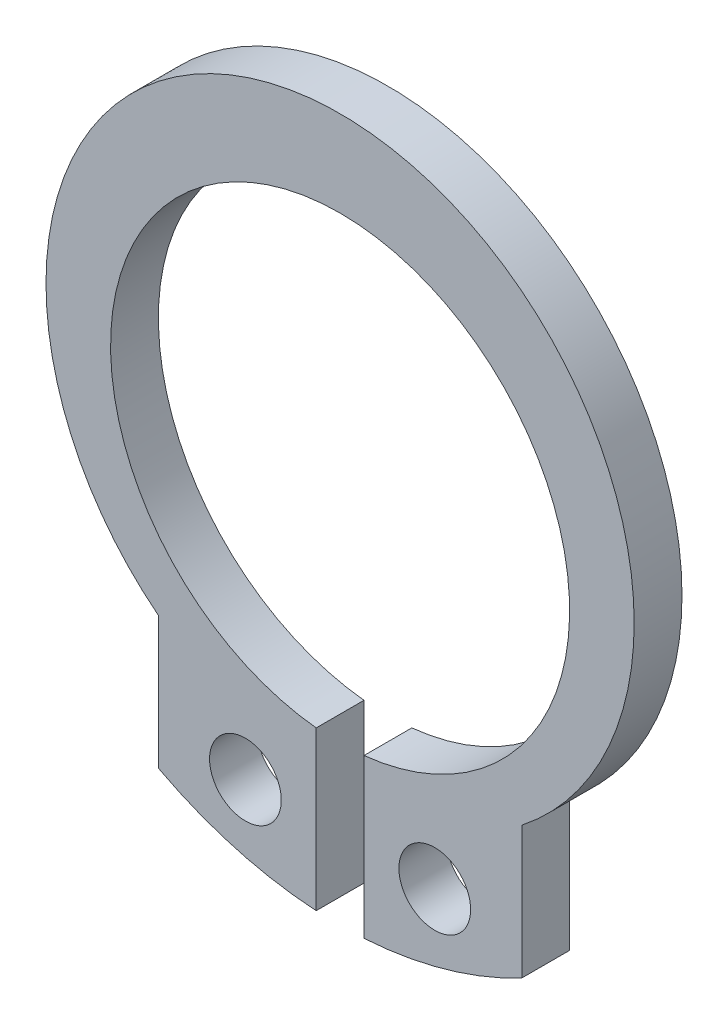
from build123d import *

# Parameters (mm, degrees)
SKIZZE1_R                       = 0.75
AUFSATZ_LINEAR_AUSTRAGEN1_DEPTH = 1


with BuildPart() as part:
    # Skizze1 → Aufsatz-Linear austragen1 (new body)
    with BuildSketch(Plane.XY.offset(1)):
        with BuildLine():
            Line((-0.5, -8.084553173), (-0.5, -4.773887305))
            ThreePointArc((-0.5, -4.773887305), (0, 4.8), (0.5, -4.773887305))
            Line((0.5, -4.773887305), (0.5, -8.084553173))
            ThreePointArc((0.5, -8.084553173), (2.199840536, -7.79555653), (3.8, -7.153320907))
            Line((3.8, -7.153320907), (3.8, -4.385545471))
            ThreePointArc((3.8, -4.385545471), (0, 6.6), (-3.8, -4.385545471))
            Line((-3.8, -4.385545471), (-3.8, -7.153320907))
            ThreePointArc((-3.8, -7.153320907), (-2.199840536, -7.79555653), (-0.5, -8.084553173))
        make_face()
        with Locations(Location((1.98, -6.45, 0), (0, 0, 180))):
            Circle(SKIZZE1_R, mode=Mode.SUBTRACT)
        with Locations(Location((-1.98, -6.45, 0), (0, 0, 180))):
            Circle(SKIZZE1_R, mode=Mode.SUBTRACT)
    extrude(amount=-AUFSATZ_LINEAR_AUSTRAGEN1_DEPTH)


solid = part.part
